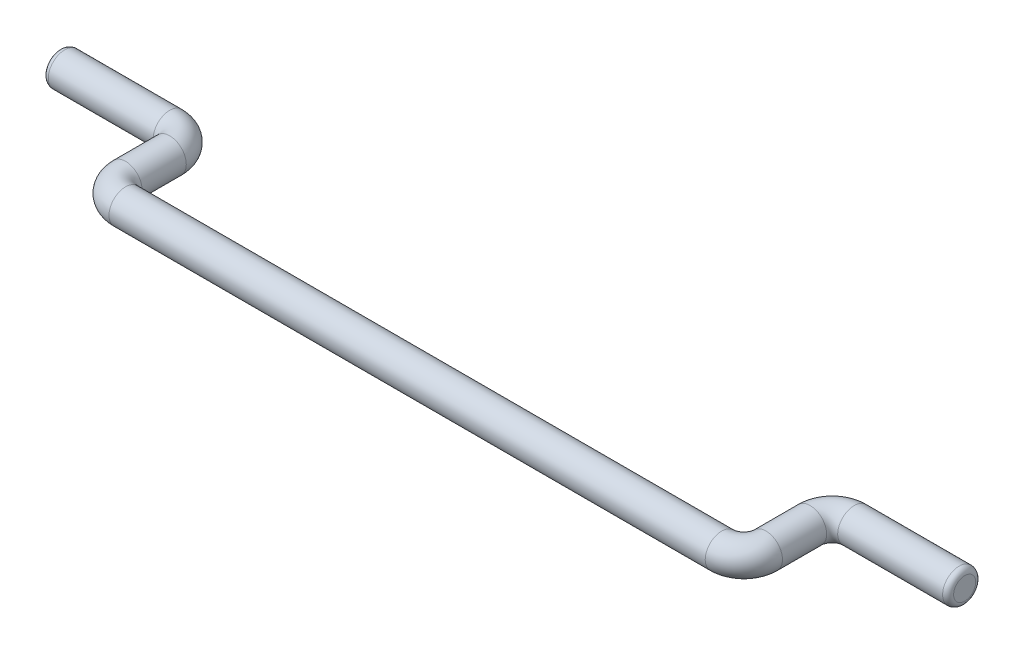
from build123d import *

# Parameters (mm, degrees)
SKETCH3_R = 0.75
FILLET1_R = 0.25


with BuildPart() as part:
    # Sweep1: sweep along a path in Sketch1
    with BuildLine(Plane(origin=(0, 0, 0), x_dir=(1, 0, 0), z_dir=(0, 1, 0))) as sweep1_path:
        Line((-6, 0), (-1, 0))
        ThreePointArc((-1, 0), (-0.292893219, -0.292893219), (0, -1))
        Line((0, -1), (0, -3))
        ThreePointArc((0, -3), (0.292893219, -3.707106781), (1, -4))
        Line((1, -4), (28, -4))
        ThreePointArc((28, -4), (28.707106781, -3.707106781), (29, -3))
        Line((29, -3), (29, -1))
        ThreePointArc((29, -1), (29.292893219, -0.292893219), (30, 0))
        Line((30, 0), (35, 0))
    # Sketch3 → Sweep1 (sweep)
    with BuildSketch(Plane(origin=(-6, 0, 0), x_dir=(0, 0, -1), z_dir=(1, 0, 0))):
        Circle(SKETCH3_R)
    sweep(path=sweep1_path.line)

    # Fillet1
    fillet1_edges = [part.edges().sort_by_distance(p)[0] for p in [
        (35, 0, 0.75),
        (-6, 0, 0.75),
    ]]
    fillet(fillet1_edges, radius=FILLET1_R)


solid = part.part
